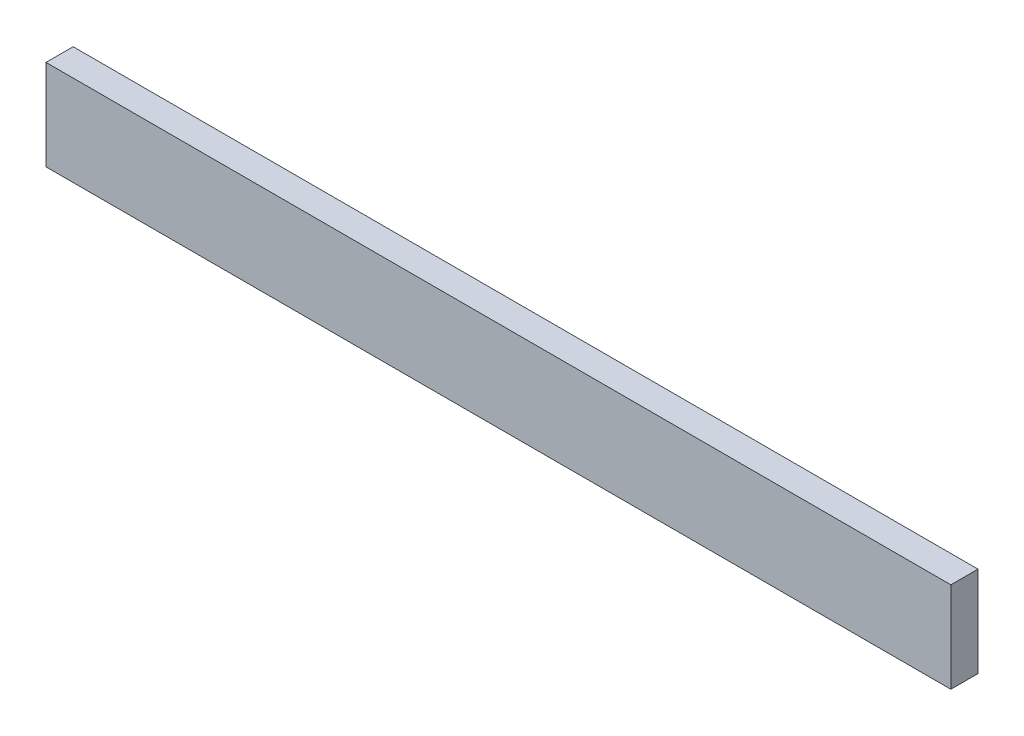
from build123d import *

# Parameters (mm, degrees)
SKETCH1_W           = 100
SKETCH1_H           = 10
BOSS_EXTRUDE1_DEPTH = 3


with BuildPart() as part:
    # Sketch1 → Boss-Extrude1 (new body)
    with BuildSketch(Plane.XY):
        with Locations((50, 5)):
            Rectangle(SKETCH1_W, SKETCH1_H)
    extrude(amount=BOSS_EXTRUDE1_DEPTH)


solid = part.part
